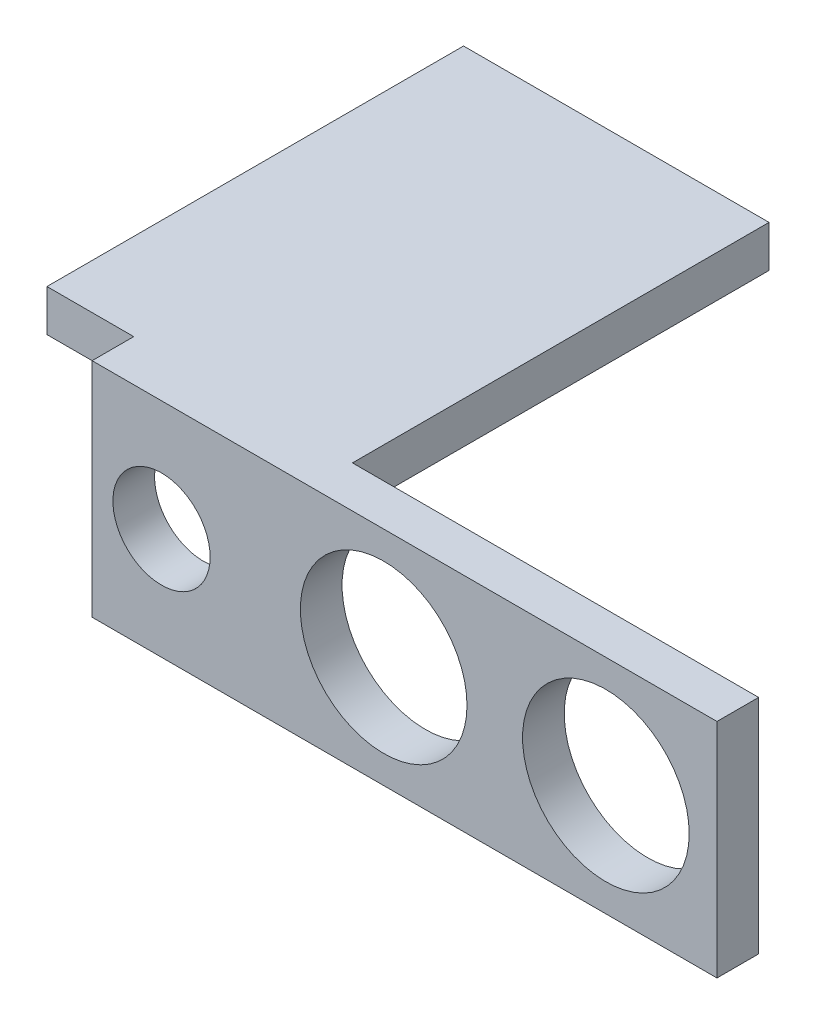
from build123d import *

# Parameters (mm, degrees)
SKETCH1_W           = 45
SKETCH1_H           = 16
SKETCH1_R           = 3.5
SKETCH1_R_2         = 6
BOSS_EXTRUDE1_DEPTH = 3
SKETCH3_W           = 22
SKETCH3_H           = 3
BOSS_EXTRUDE3_DEPTH = 30


with BuildPart() as part:
    # Sketch1 → Boss-Extrude1 (new body)
    with BuildSketch(Plane.XY):
        with Locations((22.5, -8)):
            Rectangle(SKETCH1_W, SKETCH1_H)
        with Locations((5, -8)):
            Circle(SKETCH1_R, mode=Mode.SUBTRACT)
        with Locations((21, -8)):
            Circle(SKETCH1_R_2, mode=Mode.SUBTRACT)
        with Locations((37, -8)):
            Circle(SKETCH1_R_2, mode=Mode.SUBTRACT)
    extrude(amount=BOSS_EXTRUDE1_DEPTH)

    # Sketch3 → Boss-Extrude3 (add)
    with BuildSketch(Plane(origin=(0, 0, 0), x_dir=(-1, 0, 0), z_dir=(0, 0, -1))):
        with Locations((-4.75, -1.5)):
            Rectangle(SKETCH3_W, SKETCH3_H)
    extrude(amount=BOSS_EXTRUDE3_DEPTH)


solid = part.part
